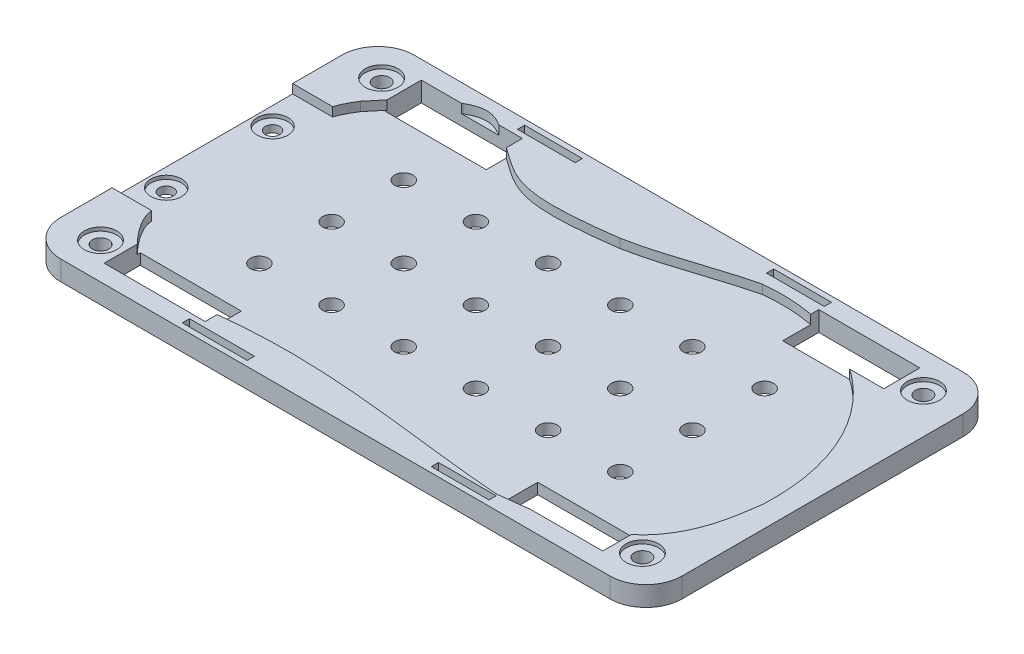
from build123d import *

# Parameters (mm, degrees)
BOSS_EXTRUDE2_DEPTH        = 6.5
CUT_EXTRUDE1_DEPTH         = 2.5
SKETCH7_W                  = 15.126318285
SKETCH7_H                  = 50.045217971
CUT_EXTRUDE2_DEPTH         = 2.5
SKETCH9_R                  = 4.5
CUT_EXTRUDE5_DEPTH         = 1
SKETCH10_R                 = 2.25
CUT_EXTRUDE6_DEPTH         = 21
SKETCH8_W                  = 28
SKETCH8_H                  = 10
CUT_EXTRUDE8_DEPTH         = 42
SKETCH8_3_W                = 12
SKETCH8_3_H                = 10
SKETCH8_3_R                = 3.5
CUT_EXTRUDE9_DEPTH         = 1
MIRROR2_COPY_1_SKETCH_R    = 4.5
MIRROR2_COPY_1_DEPTH       = 1
MIRROR2_COPY_2_SKETCH_R    = 2.25
MIRROR2_COPY_2_DEPTH       = 21
MIRROR2_COPY_3_SKETCH_W    = 28
MIRROR2_COPY_3_SKETCH_H    = 10
MIRROR2_COPY_3_DEPTH       = 42
MIRROR2_COPY_4_SKETCH_W    = 12
MIRROR2_COPY_4_SKETCH_H    = 10
MIRROR2_COPY_4_SKETCH_R    = 3.5
MIRROR2_COPY_4_DEPTH       = 1
SKETCH13_W                 = 122.138782423
SKETCH13_H                 = 57.881417702
CUT_EXTRUDE10_DEPTH        = 1
SKETCH14_R                 = 2.5
CUT_EXTRUDE11_DEPTH        = 57
SKETCH16_W                 = 16
SKETCH16_H                 = 2
SKETCH16_W_2               = 18
CUT_EXTRUDE12_DEPTH        = 57
SKETCH17_W                 = 198.020150231
SKETCH17_H                 = 122.239022266
CUT_EXTRUDE14_DEPTH        = 48.5
SKETCH23_R                 = 2
CUT_EXTRUDE15_DEPTH        = 48.5
SKETCH23_3_R               = 4.25
SKETCH23_3_R_2             = 2
CUT_EXTRUDE16_DEPTH        = 1
SKETCH24_R                 = 3.25
SKETCH24_R_2               = 2.25
BOSS_EXTRUDE3_DEPTH        = 2
MIRROR6_COPY_1_SKETCH_R    = 4.5
MIRROR6_COPY_1_DEPTH       = 1
MIRROR6_COPY_2_SKETCH_R    = 2.25
MIRROR6_COPY_2_DEPTH       = 21
MIRROR6_COPY_3_SKETCH_W    = 28
MIRROR6_COPY_3_SKETCH_H    = 10
MIRROR6_COPY_3_DEPTH       = 42
MIRROR6_COPY_4_SKETCH_W    = 12
MIRROR6_COPY_4_SKETCH_H    = 10
MIRROR6_COPY_4_SKETCH_R    = 3.5
MIRROR6_COPY_4_DEPTH       = 1
MIRROR6_COPY_5_SKETCH_R    = 4.5
MIRROR6_COPY_5_DEPTH       = 1
MIRROR6_COPY_6_SKETCH_R    = 2.25
MIRROR6_COPY_6_DEPTH       = 21
MIRROR6_COPY_7_SKETCH_W    = 28
MIRROR6_COPY_7_SKETCH_H    = 10
MIRROR6_COPY_7_DEPTH       = 42
MIRROR6_COPY_8_SKETCH_W    = 12
MIRROR6_COPY_8_SKETCH_H    = 10
MIRROR6_COPY_8_SKETCH_R    = 3.5
MIRROR6_COPY_8_DEPTH       = 1
MIRROR6_COPY_9_SKETCH_R    = 4.5
MIRROR6_COPY_9_DEPTH       = 1
MIRROR6_COPY_10_SKETCH_R   = 2.25
MIRROR6_COPY_10_DEPTH      = 21
MIRROR6_COPY_11_SKETCH_W   = 28
MIRROR6_COPY_11_SKETCH_H   = 10
MIRROR6_COPY_11_DEPTH      = 42
MIRROR6_COPY_12_SKETCH_W   = 12
MIRROR6_COPY_12_SKETCH_H   = 10
MIRROR6_COPY_12_SKETCH_R   = 3.5
MIRROR6_COPY_12_DEPTH      = 1
MIRROR6_COPY_13_SKETCH_R   = 2
MIRROR6_COPY_13_DEPTH      = 48.5
MIRROR6_COPY_14_SKETCH_R   = 4.25
MIRROR6_COPY_14_SKETCH_R_2 = 2
MIRROR6_COPY_14_DEPTH      = 1
SKETCH25_W                 = 372.013556977
SKETCH25_H                 = 329.25270551
CUT_EXTRUDE17_DEPTH        = 370


with BuildPart() as part:
    # Sketch6 → Boss-Extrude2 (new body)
    with BuildSketch(Plane(origin=(0, 0, 0), x_dir=(1, 0, 0), z_dir=(0, 1, 0))):
        with BuildLine():
            Line((73.981646775, 59.583909473), (-78.157135648, 59.583909473))
            ThreePointArc((-78.157135648, 59.583909473), (-85.22820346, 56.654977285), (-88.157135648, 49.583909473))
            Line((-88.157135648, 49.583909473), (-88.157135648, -28.297508229))
            ThreePointArc((-88.157135648, -28.297508229), (-85.22820346, -35.368576041), (-78.157135648, -38.297508229))
            Line((-78.157135648, -38.297508229), (73.981646775, -38.297508229))
            ThreePointArc((73.981646775, -38.297508229), (81.052714587, -35.368576041), (83.981646775, -28.297508229))
            Line((83.981646775, -28.297508229), (83.981646775, 49.583909473))
            ThreePointArc((83.981646775, 49.583909473), (81.052714587, 56.654977285), (73.981646775, 59.583909473))
        make_face()
    boss_extrude2 = extrude(amount=BOSS_EXTRUDE2_DEPTH)

    # Sketch1 → Cut-Extrude1 (cut)
    with BuildSketch(Plane(origin=(0, 0, 0), x_dir=(1, 0, 0), z_dir=(0, 1, 0))):
        with BuildLine():
            Line((77.806365081, -0.96565382), (-77.157134057, -0.96565382))
            Line((-77.157134057, -0.96565382), (-77.157133487, -14.112200011))
            add(Edge.make_bspline(
                [(-77.157133487, -14.112200011), (-77.156536942, -14.370123486), (-77.109197781, -14.873209632), (-76.835922488, -15.955912897), (-76.187889009, -17.500769448), (-75.043983016, -19.418277882), (-73.152039277, -22.009216703), (-70.349522729, -25.082160357), (-66.873619377, -28.097169115), (-63.686430755, -30.214139025), (-61.001852204, -31.406236435), (-58.827378352, -31.848010778), (-57.571800044, -31.879365283), (-56.919048161, -31.916770504)],
                knots=[0.000484301, 0.000484301, 0.000484301, 0.000484301, 0.031521334, 0.062558366, 0.124632431, 0.186706496, 0.248780561, 0.37292869, 0.49707682, 0.62122495, 0.745373079, 0.869521209, 0.993669339, 0.993669339, 0.993669339, 0.993669339], degree=3))
            add(Edge.make_bspline(
                [(-56.919048161, -31.916770504), (-56.676855651, -31.887329504), (-56.202107187, -31.827411173), (-55.17909933, -31.687000892), (-53.829380758, -31.487736495), (-52.075898695, -31.218386946), (-49.57440565, -30.835368063), (-46.14645809, -30.337211074), (-41.582465958, -29.781294531), (-36.59758114, -29.326101352), (-29.427370913, -28.913030471), (-19.557102597, -28.846779859), (-6.483877393, -29.587535165), (5.244808229, -30.786505775), (15.023020088, -31.929485511), (22.521025078, -32.809036887), (30.153844065, -33.641998773), (35.340846207, -34.107490241), (37.926285135, -34.298975741)],
                knots=[0.000538145, 0.000538145, 0.000538145, 0.000538145, 0.016151963, 0.031765781, 0.062993416, 0.094221052, 0.125448688, 0.18790396, 0.250359232, 0.312814503, 0.375269775, 0.500180319, 0.625090862, 0.750001406, 0.812456678, 0.874911949, 0.937367221, 0.999822493, 0.999822493, 0.999822493, 0.999822493], degree=3))
            ThreePointArc((37.926285135, -34.298975741), (38.702526051, -34.294429262), (39.475271872, -34.220710033))
            add(Edge.make_bspline(
                [(39.475271872, -34.220710033), (41.007855914, -34.057436076), (44.089984585, -33.714701696), (50.083540013, -32.842915348), (57.096899249, -31.185924421), (64.218389099, -27.883874428), (69.776327895, -23.185685517), (73.049743993, -18.278857828), (74.917700916, -14.026885359), (75.980532113, -10.773207259), (76.750872111, -7.572378035), (77.199527425, -5.064024493), (77.479780782, -3.227934), (77.653952405, -2.012317888), (77.758523252, -1.282417326), (77.806365081, -0.96565382)],
                knots=[-0.000308659, -0.000308659, -0.000308659, -0.000308659, 0.063093373, 0.126495404, 0.253299468, 0.380103532, 0.506907596, 0.633711659, 0.697113691, 0.760515723, 0.823917755, 0.887319787, 0.919020803, 0.950721818, 0.978851886, 0.978851886, 0.978851886, 0.978851886], degree=3))
        make_face()
        with BuildLine():
            Line((-77.157135648, 35.76464303), (-77.157134057, -0.96565382))
            Line((-77.157134057, -0.96565382), (77.806365081, -0.96565382))
            add(Edge.make_bspline(
                [(77.806365081, -0.96565382), (77.812438323, -0.925442533), (77.87221605, -0.53245946), (77.930059012, -0.183407073), (77.984899751, 0.147711222)],
                knots=[0.978851886, 0.978851886, 0.978851886, 0.978851886, 0.982422834, 1.01412385, 1.01412385, 1.01412385, 1.01412385], degree=3))
            add(Edge.make_bspline(
                [(77.984899751, 0.147711222), (78.028632075, 1.263321996), (78.063685274, 3.522430751), (77.942610131, 6.756968322), (77.659550444, 9.90467033), (77.073307047, 13.967118446), (75.962568899, 18.783585703), (73.443316656, 25.935742417), (69.020568834, 33.80984715), (62.049489108, 41.493231365), (53.789484117, 47.344418041), (44.612113932, 51.294661515), (34.903628635, 53.280392725), (28.311253849, 53.235690332), (25.060177828, 52.873239487)],
                knots=[0.000169226, 0.000169226, 0.000169226, 0.000169226, 0.031413574, 0.062657922, 0.09390227, 0.125146618, 0.187635314, 0.25012401, 0.375101401, 0.500078793, 0.625056185, 0.750033577, 0.875010969, 0.999988361, 0.999988361, 0.999988361, 0.999988361], degree=3))
            add(Edge.make_bspline(
                [(25.060177828, 52.873239487), (19.895446944, 51.629390577), (12.322434608, 49.13169364), (2.160698602, 45.971278142), (-3.037110446, 44.691336857), (-5.659268145, 44.190364293)],
                knots=[0.000658959, 0.000658959, 0.000658959, 0.000658959, 0.498067368, 0.746771573, 0.995475778, 0.995475778, 0.995475778, 0.995475778], degree=3))
            add(Edge.make_bspline(
                [(-5.659268145, 44.190364293), (-6.687899132, 44.046149587), (-8.728734339, 43.771857825), (-12.963271971, 43.266800577), (-18.182613839, 42.795189919), (-23.901458121, 42.63215561), (-28.830638135, 42.989857068), (-32.966568973, 43.951399156), (-35.917714049, 45.291439085), (-38.19591431, 46.677930402), (-39.939161114, 47.865789175), (-41.506959745, 48.979842665), (-42.863802202, 49.929184347), (-43.616290768, 50.440510486), (-43.98532936, 50.688555671)],
                knots=[-0.00019559, -0.00019559, -0.00019559, -0.00019559, 0.062587211, 0.125370012, 0.250935613, 0.376501215, 0.502066816, 0.627632417, 0.753198019, 0.81598082, 0.87876362, 0.941546421, 0.972937821, 1.004329222, 1.004329222, 1.004329222, 1.004329222], degree=3))
            add(Edge.make_bspline(
                [(-43.98532936, 50.688555671), (-44.244485854, 50.867312015), (-44.768150418, 51.232519494), (-45.750657054, 51.933111662), (-46.891239492, 52.75905139), (-48.145972585, 53.649626958), (-49.697116091, 54.681113287), (-51.460780236, 55.648746777), (-53.407719169, 56.259273829), (-55.251731489, 56.357375065), (-56.710973324, 56.08081223), (-57.794758617, 55.713765742), (-58.546542767, 55.391458897), (-59.229896481, 55.042763399), (-59.583745645, 54.835934013), (-59.770155285, 54.723823826)],
                knots=[-0.002497219, -0.002497219, -0.002497219, -0.002497219, 0.029065652, 0.060628523, 0.123754265, 0.186880007, 0.250005749, 0.376257234, 0.502508718, 0.628760202, 0.755011687, 0.818137429, 0.881263171, 0.944388913, 1.007514655, 1.007514655, 1.007514655, 1.007514655], degree=3))
            add(Edge.make_bspline(
                [(-59.770155285, 54.723823826), (-60.193626174, 54.476092852), (-61.03864602, 53.961192652), (-62.636768194, 52.907176262), (-65.258656407, 50.976312285), (-68.51709364, 48.049765778), (-71.244275363, 45.065662035), (-73.189921829, 42.724657875), (-74.069794154, 41.617885903), (-74.515784144, 41.052117052)],
                knots=[0.000174078, 0.000174078, 0.000174078, 0.000174078, 0.062881444, 0.12558881, 0.251003541, 0.501833004, 0.752662466, 0.878077198, 1.003491929, 1.003491929, 1.003491929, 1.003491929], degree=3))
            add(Edge.make_bspline(
                [(-74.515784144, 41.052117052), (-75.065753244, 40.22169422), (-76.07645723, 38.477870595), (-76.833603448, 36.687528936), (-77.157135648, 35.76464303)],
                knots=[0.499549048, 0.499549048, 0.499549048, 0.499549048, 0.499765799, 0.49998255, 0.49998255, 0.49998255, 0.49998255], degree=3))
        make_face()
    cut_extrude1 = extrude(amount=CUT_EXTRUDE1_DEPTH, mode=Mode.SUBTRACT)

    # Sketch7 → Cut-Extrude2 (cut)
    with BuildSketch(Plane.XZ):
        with Locations((-83.782077592, -10.91040897)):
            Rectangle(SKETCH7_W, SKETCH7_H)
    cut_extrude2 = extrude(amount=-CUT_EXTRUDE2_DEPTH, mode=Mode.SUBTRACT)

    # Sketch9 → Cut-Extrude5 (cut)
    with BuildSketch(Plane.XZ):
        with Locations(Location((72.981646775, -49.583909473, 0), (0, 0, 270))):
            Circle(SKETCH9_R)
    cut_extrude5 = extrude(amount=-CUT_EXTRUDE5_DEPTH, mode=Mode.SUBTRACT)

    # Sketch10 → Cut-Extrude6 (cut)
    with BuildSketch(Plane.XZ.offset(-1)):
        with Locations(Location((72.981646775, -49.583909473, 0), (0, 0, 270))):
            Circle(SKETCH10_R)
    cut_extrude6 = extrude(amount=-CUT_EXTRUDE6_DEPTH, mode=Mode.SUBTRACT)

    # Sketch8 → Cut-Extrude8 (cut)
    with BuildSketch(Plane(origin=(0, 6.5, 0), x_dir=(1, 0, 0), z_dir=(0, 1, 0))):
        with Locations((52.981646775, 49.583909473)):
            Rectangle(SKETCH8_W, SKETCH8_H)
    cut_extrude8 = extrude(amount=-CUT_EXTRUDE8_DEPTH, mode=Mode.SUBTRACT)

    # Sketch8<3> → Cut-Extrude9 (cut)
    with BuildSketch(Plane(origin=(0, 6.5, 0), x_dir=(1, 0, 0), z_dir=(0, 1, 0))):
        with Locations((72.981646775, 49.583909473)):
            Rectangle(SKETCH8_3_W, SKETCH8_3_H)
        with Locations(Location((72.981646775, 49.583909473, 0), (0, 0, 270))):
            Circle(SKETCH8_3_R, mode=Mode.SUBTRACT)
    cut_extrude9 = extrude(amount=-CUT_EXTRUDE9_DEPTH, mode=Mode.SUBTRACT)

    # Mirror1: Cut-Extrude5, Cut-Extrude6, Cut-Extrude8, Cut-Extrude9 across plane
    add(cut_extrude5.mirror(Plane.XY.offset(-10.643200622)), mode=Mode.SUBTRACT)
    add(cut_extrude6.mirror(Plane.XY.offset(-10.643200622)), mode=Mode.SUBTRACT)
    add(cut_extrude8.mirror(Plane.XY.offset(-10.643200622)), mode=Mode.SUBTRACT)
    add(cut_extrude9.mirror(Plane.XY.offset(-10.643200622)), mode=Mode.SUBTRACT)

    # Mirror2: Cut-Extrude5, Cut-Extrude6, Cut-Extrude8, Cut-Extrude9 across plane
    add(cut_extrude5.mirror(Plane.ZY.offset(2.087744437)), mode=Mode.SUBTRACT)
    add(cut_extrude6.mirror(Plane.ZY.offset(2.087744437)), mode=Mode.SUBTRACT)
    add(cut_extrude8.mirror(Plane.ZY.offset(2.087744437)), mode=Mode.SUBTRACT)
    add(cut_extrude9.mirror(Plane.ZY.offset(2.087744437)), mode=Mode.SUBTRACT)

    # Mirror2 copy 1 sketch → Mirror2 copy 1 (cut)
    with BuildSketch(Plane(origin=(-4.175488873, 0, -21.286401244), x_dir=(-1, 0, 0), z_dir=(0, -1, 0))):
        with Locations(Location((72.981646775, -49.583909473, 0), (0, 0, 270))):
            Circle(MIRROR2_COPY_1_SKETCH_R)
    extrude(amount=-MIRROR2_COPY_1_DEPTH, mode=Mode.SUBTRACT)

    # Mirror2 copy 2 sketch → Mirror2 copy 2 (cut)
    with BuildSketch(Plane(origin=(-4.175488873, 1, -21.286401244), x_dir=(-1, 0, 0), z_dir=(0, -1, 0))):
        with Locations(Location((72.981646775, -49.583909473, 0), (0, 0, 270))):
            Circle(MIRROR2_COPY_2_SKETCH_R)
    extrude(amount=-MIRROR2_COPY_2_DEPTH, mode=Mode.SUBTRACT)

    # Mirror2 copy 3 sketch → Mirror2 copy 3 (cut)
    with BuildSketch(Plane(origin=(-4.175488873, 6.5, -21.286401244), x_dir=(-1, 0, 0), z_dir=(0, 1, 0))):
        with Locations((52.981646775, 49.583909473)):
            Rectangle(MIRROR2_COPY_3_SKETCH_W, MIRROR2_COPY_3_SKETCH_H)
    extrude(amount=-MIRROR2_COPY_3_DEPTH, mode=Mode.SUBTRACT)

    # Mirror2 copy 4 sketch → Mirror2 copy 4 (cut)
    with BuildSketch(Plane(origin=(-4.175488873, 6.5, -21.286401244), x_dir=(-1, 0, 0), z_dir=(0, 1, 0))):
        with Locations((72.981646775, 49.583909473)):
            Rectangle(MIRROR2_COPY_4_SKETCH_W, MIRROR2_COPY_4_SKETCH_H)
        with Locations(Location((72.981646775, 49.583909473, 0), (0, 0, 270))):
            Circle(MIRROR2_COPY_4_SKETCH_R, mode=Mode.SUBTRACT)
    extrude(amount=-MIRROR2_COPY_4_DEPTH, mode=Mode.SUBTRACT)

    # Sketch13 → Cut-Extrude10 (cut)
    with BuildSketch(Plane(origin=(0, 6.5, 0), x_dir=(1, 0, 0), z_dir=(0, 1, 0))):
        with Locations((-2.087744436, 10.643200622)):
            Rectangle(SKETCH13_W, SKETCH13_H)
    cut_extrude10 = extrude(amount=-CUT_EXTRUDE10_DEPTH, mode=Mode.SUBTRACT)

    # Sketch14 → Cut-Extrude11 (cut)
    with BuildSketch(Plane(origin=(0, 5.5, 0), x_dir=(1, 0, 0), z_dir=(0, 1, 0))):
        with Locations(Location((-52.087744437, 30.643200622, 0), (0, 0, 270))):
            Circle(SKETCH14_R)
        with Locations(Location((7.912255563, 30.643200622, 0), (0, 0, 270))):
            Circle(SKETCH14_R)
        with Locations(Location((27.912255563, 30.643200622, 0), (0, 0, 270))):
            Circle(SKETCH14_R)
        with Locations(Location((47.912255563, 30.643200622, 0), (0, 0, 270))):
            Circle(SKETCH14_R)
        with Locations(Location((47.912255563, 10.643200622, 0), (0, 0, 270))):
            Circle(SKETCH14_R)
        with Locations(Location((7.912255563, 10.643200622, 0), (0, 0, 270))):
            Circle(SKETCH14_R)
        with Locations(Location((-12.087744437, 10.643200622, 0), (0, 0, 270))):
            Circle(SKETCH14_R)
        with Locations(Location((-32.087744437, 10.643200622, 0), (0, 0, 270))):
            Circle(SKETCH14_R)
        with Locations(Location((-52.087744437, 10.643200622, 0), (0, 0, 270))):
            Circle(SKETCH14_R)
        with Locations(Location((47.912255563, -9.356799378, 0), (0, 0, 270))):
            Circle(SKETCH14_R)
        with Locations(Location((27.912255563, -9.356799378, 0), (0, 0, 270))):
            Circle(SKETCH14_R)
        with Locations(Location((7.912255563, -9.356799378, 0), (0, 0, 270))):
            Circle(SKETCH14_R)
        with Locations(Location((-12.087744437, -9.356799378, 0), (0, 0, 270))):
            Circle(SKETCH14_R)
        with Locations(Location((-32.087744437, -9.356799378, 0), (0, 0, 270))):
            Circle(SKETCH14_R)
        with Locations(Location((-52.087744437, -9.356799378, 0), (0, 0, 270))):
            Circle(SKETCH14_R)
        with Locations(Location((-32.087744437, 30.643200622, 0), (0, 0, 270))):
            Circle(SKETCH14_R)
        with Locations(Location((-12.087744437, 30.643200622, 0), (0, 0, 270))):
            Circle(SKETCH14_R)
        with Locations(Location((27.912255563, 10.643200622, 0), (0, 0, 270))):
            Circle(SKETCH14_R)
    cut_extrude11 = extrude(amount=-CUT_EXTRUDE11_DEPTH, mode=Mode.SUBTRACT)

    # Sketch16 → Cut-Extrude12 (cut)
    with BuildSketch(Plane.XZ):
        with Locations((30.981646775, -57.083909473)):
            Rectangle(SKETCH16_W, SKETCH16_H)
        with Locations((30.981646775, 35.797508229)):
            Rectangle(SKETCH16_W, SKETCH16_H)
        with Locations((-38.018353225, -57.083909473)):
            Rectangle(SKETCH16_W, SKETCH16_H)
        with Locations((-37.018353225, 35.797508229)):
            Rectangle(SKETCH16_W_2, SKETCH16_H)
    cut_extrude12 = extrude(amount=-CUT_EXTRUDE12_DEPTH, mode=Mode.SUBTRACT)

    # Sketch17 → Cut-Extrude14 (cut)
    with BuildSketch(Plane(origin=(0, 5.5, 0), x_dir=(1, 0, 0), z_dir=(0, 1, 0))):
        with Locations((-0.586253557, 7.90518784)):
            Rectangle(SKETCH17_W, SKETCH17_H)
    cut_extrude14 = extrude(amount=CUT_EXTRUDE14_DEPTH, mode=Mode.SUBTRACT)

    # Sketch23 → Cut-Extrude15 (cut)
    with BuildSketch(Plane.XZ.offset(-2.5)):
        with Locations(Location((-83.157135648, 4.08959103, 0), (0, 0, 270))):
            Circle(SKETCH23_R)
    cut_extrude15 = extrude(amount=-CUT_EXTRUDE15_DEPTH, mode=Mode.SUBTRACT)

    # Sketch23<3> → Cut-Extrude16 (cut)
    with BuildSketch(Plane.XZ.offset(-2.5)):
        with Locations(Location((-83.157135648, 4.08959103, 0), (0, 0, 270))):
            Circle(SKETCH23_3_R)
        with Locations(Location((-83.157135648, 4.08959103, 0), (0, 0, 270))):
            Circle(SKETCH23_3_R_2, mode=Mode.SUBTRACT)
    cut_extrude16 = extrude(amount=-CUT_EXTRUDE16_DEPTH, mode=Mode.SUBTRACT)

    # Mirror4: Cut-Extrude15, Cut-Extrude16 across plane
    add(cut_extrude15.mirror(Plane.XY.offset(-10.643200622)), mode=Mode.SUBTRACT)
    add(cut_extrude16.mirror(Plane.XY.offset(-10.643200622)), mode=Mode.SUBTRACT)

    # Sketch24 → Boss-Extrude3 (add)
    # profile 1 of 4: a face of its own
    with BuildSketch(Plane(origin=(0, 5.5, 0), x_dir=(1, 0, 0), z_dir=(0, 1, 0))):
        with Locations(Location((-77.157135648, 49.583909473, 0), (0, 0, 270))):
            Circle(SKETCH24_R)
        with Locations(Location((-77.157135648, 49.583909473, 0), (0, 0, 90))):
            Circle(SKETCH24_R_2, mode=Mode.SUBTRACT)
    # profile 2 of 4: a face of its own
    with BuildSketch(Plane(origin=(0, 5.5, 0), x_dir=(1, 0, 0), z_dir=(0, 1, 0))):
        with Locations(Location((72.981646775, 49.583909473, 0), (0, 0, 270))):
            Circle(SKETCH24_R)
        with Locations(Location((72.981646775, 49.583909473, 0), (0, 0, 90))):
            Circle(SKETCH24_R_2, mode=Mode.SUBTRACT)
    # profile 3 of 4: a face of its own
    with BuildSketch(Plane(origin=(0, 5.5, 0), x_dir=(1, 0, 0), z_dir=(0, 1, 0))):
        with Locations(Location((-77.157135648, -28.297508229, 0), (0, 0, 270))):
            Circle(SKETCH24_R)
        with Locations(Location((-77.157135648, -28.297508229, 0), (0, 0, 270))):
            Circle(SKETCH24_R_2, mode=Mode.SUBTRACT)
    # profile 4 of 4: a face of its own
    with BuildSketch(Plane(origin=(0, 5.5, 0), x_dir=(1, 0, 0), z_dir=(0, 1, 0))):
        with Locations(Location((72.981646775, -28.297508229, 0), (0, 0, 270))):
            Circle(SKETCH24_R)
        with Locations(Location((72.981646775, -28.297508229, 0), (0, 0, 270))):
            Circle(SKETCH24_R_2, mode=Mode.SUBTRACT)
    boss_extrude3 = extrude(amount=BOSS_EXTRUDE3_DEPTH)

    # Mirror6: Boss-Extrude2, Cut-Extrude1, Cut-Extrude2, Cut-Extrude5, Cut-Extrude6, Cut-Extrude8, Cut-Extrude9, Cut-Extrude10, Cut-Extrude11, Cut-Extrude12, Cut-Extrude14, Cut-Extrude15, Cut-Extrude16, Boss-Extrude3 across plane
    add(boss_extrude2.mirror(Plane(origin=(0, 0, 0), x_dir=(0, 0, 1), z_dir=(0, -1, 0))))
    add(cut_extrude1.mirror(Plane(origin=(0, 0, 0), x_dir=(0, 0, 1), z_dir=(0, -1, 0))), mode=Mode.SUBTRACT)
    add(cut_extrude2.mirror(Plane(origin=(0, 0, 0), x_dir=(0, 0, 1), z_dir=(0, -1, 0))), mode=Mode.SUBTRACT)
    add(cut_extrude5.mirror(Plane(origin=(0, 0, 0), x_dir=(0, 0, 1), z_dir=(0, -1, 0))), mode=Mode.SUBTRACT)
    add(cut_extrude6.mirror(Plane(origin=(0, 0, 0), x_dir=(0, 0, 1), z_dir=(0, -1, 0))), mode=Mode.SUBTRACT)
    add(cut_extrude8.mirror(Plane(origin=(0, 0, 0), x_dir=(0, 0, 1), z_dir=(0, -1, 0))), mode=Mode.SUBTRACT)
    add(cut_extrude9.mirror(Plane(origin=(0, 0, 0), x_dir=(0, 0, 1), z_dir=(0, -1, 0))), mode=Mode.SUBTRACT)
    add(cut_extrude10.mirror(Plane(origin=(0, 0, 0), x_dir=(0, 0, 1), z_dir=(0, -1, 0))), mode=Mode.SUBTRACT)
    add(cut_extrude11.mirror(Plane(origin=(0, 0, 0), x_dir=(0, 0, 1), z_dir=(0, -1, 0))), mode=Mode.SUBTRACT)
    add(cut_extrude12.mirror(Plane(origin=(0, 0, 0), x_dir=(0, 0, 1), z_dir=(0, -1, 0))), mode=Mode.SUBTRACT)
    add(cut_extrude14.mirror(Plane(origin=(0, 0, 0), x_dir=(0, 0, 1), z_dir=(0, -1, 0))), mode=Mode.SUBTRACT)
    add(cut_extrude15.mirror(Plane(origin=(0, 0, 0), x_dir=(0, 0, 1), z_dir=(0, -1, 0))), mode=Mode.SUBTRACT)
    add(cut_extrude16.mirror(Plane(origin=(0, 0, 0), x_dir=(0, 0, 1), z_dir=(0, -1, 0))), mode=Mode.SUBTRACT)
    add(boss_extrude3.mirror(Plane(origin=(0, 0, 0), x_dir=(0, 0, 1), z_dir=(0, -1, 0))))

    # Mirror6 copy 1 sketch → Mirror6 copy 1 (cut)
    with BuildSketch(Plane(origin=(0, 0, -21.286401244), x_dir=(1, 0, 0), z_dir=(0, 1, 0))):
        with Locations(Location((72.981646775, -49.583909473, 0), (0, 0, 270))):
            Circle(MIRROR6_COPY_1_SKETCH_R)
    extrude(amount=-MIRROR6_COPY_1_DEPTH, mode=Mode.SUBTRACT)

    # Mirror6 copy 2 sketch → Mirror6 copy 2 (cut)
    with BuildSketch(Plane(origin=(0, -1, -21.286401244), x_dir=(1, 0, 0), z_dir=(0, 1, 0))):
        with Locations(Location((72.981646775, -49.583909473, 0), (0, 0, 270))):
            Circle(MIRROR6_COPY_2_SKETCH_R)
    extrude(amount=-MIRROR6_COPY_2_DEPTH, mode=Mode.SUBTRACT)

    # Mirror6 copy 3 sketch → Mirror6 copy 3 (cut)
    with BuildSketch(Plane(origin=(0, -6.5, -21.286401244), x_dir=(1, 0, 0), z_dir=(0, -1, 0))):
        with Locations((52.981646775, 49.583909473)):
            Rectangle(MIRROR6_COPY_3_SKETCH_W, MIRROR6_COPY_3_SKETCH_H)
    extrude(amount=-MIRROR6_COPY_3_DEPTH, mode=Mode.SUBTRACT)

    # Mirror6 copy 4 sketch → Mirror6 copy 4 (cut)
    with BuildSketch(Plane(origin=(0, -6.5, -21.286401244), x_dir=(1, 0, 0), z_dir=(0, -1, 0))):
        with Locations((72.981646775, 49.583909473)):
            Rectangle(MIRROR6_COPY_4_SKETCH_W, MIRROR6_COPY_4_SKETCH_H)
        with Locations(Location((72.981646775, 49.583909473, 0), (0, 0, 270))):
            Circle(MIRROR6_COPY_4_SKETCH_R, mode=Mode.SUBTRACT)
    extrude(amount=-MIRROR6_COPY_4_DEPTH, mode=Mode.SUBTRACT)

    # Mirror6 copy 5 sketch → Mirror6 copy 5 (cut)
    with BuildSketch(Plane(origin=(-4.175488873, 0, 0), x_dir=(-1, 0, 0), z_dir=(0, 1, 0))):
        with Locations(Location((72.981646775, -49.583909473, 0), (0, 0, 270))):
            Circle(MIRROR6_COPY_5_SKETCH_R)
    extrude(amount=-MIRROR6_COPY_5_DEPTH, mode=Mode.SUBTRACT)

    # Mirror6 copy 6 sketch → Mirror6 copy 6 (cut)
    with BuildSketch(Plane(origin=(-4.175488873, -1, 0), x_dir=(-1, 0, 0), z_dir=(0, 1, 0))):
        with Locations(Location((72.981646775, -49.583909473, 0), (0, 0, 270))):
            Circle(MIRROR6_COPY_6_SKETCH_R)
    extrude(amount=-MIRROR6_COPY_6_DEPTH, mode=Mode.SUBTRACT)

    # Mirror6 copy 7 sketch → Mirror6 copy 7 (cut)
    with BuildSketch(Plane(origin=(-4.175488873, -6.5, 0), x_dir=(-1, 0, 0), z_dir=(0, -1, 0))):
        with Locations((52.981646775, 49.583909473)):
            Rectangle(MIRROR6_COPY_7_SKETCH_W, MIRROR6_COPY_7_SKETCH_H)
    extrude(amount=-MIRROR6_COPY_7_DEPTH, mode=Mode.SUBTRACT)

    # Mirror6 copy 8 sketch → Mirror6 copy 8 (cut)
    with BuildSketch(Plane(origin=(-4.175488873, -6.5, 0), x_dir=(-1, 0, 0), z_dir=(0, -1, 0))):
        with Locations((72.981646775, 49.583909473)):
            Rectangle(MIRROR6_COPY_8_SKETCH_W, MIRROR6_COPY_8_SKETCH_H)
        with Locations(Location((72.981646775, 49.583909473, 0), (0, 0, 270))):
            Circle(MIRROR6_COPY_8_SKETCH_R, mode=Mode.SUBTRACT)
    extrude(amount=-MIRROR6_COPY_8_DEPTH, mode=Mode.SUBTRACT)

    # Mirror6 copy 9 sketch → Mirror6 copy 9 (cut)
    with BuildSketch(Plane(origin=(-4.175488873, 0, -21.286401244), x_dir=(-1, 0, 0), z_dir=(0, 1, 0))):
        with Locations((72.981646775, 49.583909473)):
            Circle(MIRROR6_COPY_9_SKETCH_R)
    extrude(amount=-MIRROR6_COPY_9_DEPTH, mode=Mode.SUBTRACT)

    # Mirror6 copy 10 sketch → Mirror6 copy 10 (cut)
    with BuildSketch(Plane(origin=(-4.175488873, -1, -21.286401244), x_dir=(-1, 0, 0), z_dir=(0, 1, 0))):
        with Locations((72.981646775, 49.583909473)):
            Circle(MIRROR6_COPY_10_SKETCH_R)
    extrude(amount=-MIRROR6_COPY_10_DEPTH, mode=Mode.SUBTRACT)

    # Mirror6 copy 11 sketch → Mirror6 copy 11 (cut)
    with BuildSketch(Plane(origin=(-4.175488873, -6.5, -21.286401244), x_dir=(-1, 0, 0), z_dir=(0, -1, 0))):
        with Locations((52.981646775, -49.583909473)):
            Rectangle(MIRROR6_COPY_11_SKETCH_W, MIRROR6_COPY_11_SKETCH_H)
    extrude(amount=-MIRROR6_COPY_11_DEPTH, mode=Mode.SUBTRACT)

    # Mirror6 copy 12 sketch → Mirror6 copy 12 (cut)
    with BuildSketch(Plane(origin=(-4.175488873, -6.5, -21.286401244), x_dir=(-1, 0, 0), z_dir=(0, -1, 0))):
        with Locations((72.981646775, -49.583909473)):
            Rectangle(MIRROR6_COPY_12_SKETCH_W, MIRROR6_COPY_12_SKETCH_H)
        with Locations((72.981646775, -49.583909473)):
            Circle(MIRROR6_COPY_12_SKETCH_R, mode=Mode.SUBTRACT)
    extrude(amount=-MIRROR6_COPY_12_DEPTH, mode=Mode.SUBTRACT)

    # Mirror6 copy 13 sketch → Mirror6 copy 13 (cut)
    with BuildSketch(Plane(origin=(0, -2.5, -21.286401244), x_dir=(1, 0, 0), z_dir=(0, 1, 0))):
        with Locations(Location((-83.157135648, 4.08959103, 0), (0, 0, 270))):
            Circle(MIRROR6_COPY_13_SKETCH_R)
    extrude(amount=-MIRROR6_COPY_13_DEPTH, mode=Mode.SUBTRACT)

    # Mirror6 copy 14 sketch → Mirror6 copy 14 (cut)
    with BuildSketch(Plane(origin=(0, -2.5, -21.286401244), x_dir=(1, 0, 0), z_dir=(0, 1, 0))):
        with Locations(Location((-83.157135648, 4.08959103, 0), (0, 0, 270))):
            Circle(MIRROR6_COPY_14_SKETCH_R)
        with Locations(Location((-83.157135648, 4.08959103, 0), (0, 0, 270))):
            Circle(MIRROR6_COPY_14_SKETCH_R_2, mode=Mode.SUBTRACT)
    extrude(amount=-MIRROR6_COPY_14_DEPTH, mode=Mode.SUBTRACT)

    # Sketch25 → Cut-Extrude17 (cut)
    with BuildSketch(Plane(origin=(0, 0, 0), x_dir=(-1, 0, 0), z_dir=(0, -1, 0))):
        with Locations((30.029241892, -27.015771239)):
            Rectangle(SKETCH25_W, SKETCH25_H)
    extrude(amount=-CUT_EXTRUDE17_DEPTH, mode=Mode.SUBTRACT)


solid = part.part
